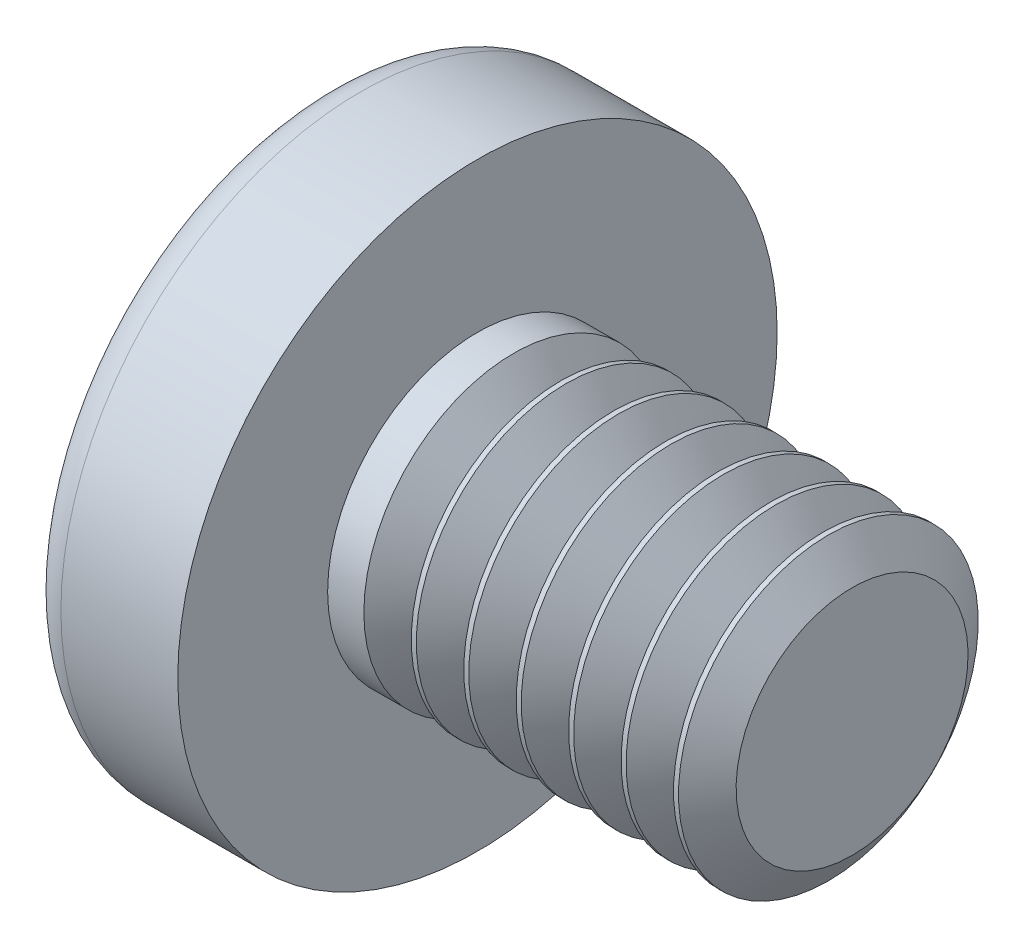
from build123d import *

# Parameters (mm, degrees)
CIRPATTERN1_COUNT = 2
CIRPATTERN1_ANGLE = 90
THDSCHPAT_COUNT   = 7
THDSCHPAT_PITCH   = 0.35


with BuildPart() as part:
    # BodySke → Base-Revolve (revolve)
    with BuildSketch(Plane.XY, mode=Mode.PRIVATE) as base_revolve_sk:
        with BuildLine():
            Line((1.6, 1), (1.6, 2))
            Line((1.6, 2), (0.820084035, 2))
            ThreePointArc((0.820084035, 2), (0.712029995, 1.974299613), (0.627117876, 1.902702703))
            ThreePointArc((0.627117876, 1.902702703), (0.160820604, 1.001692868), (0, 0))
            Line((0, 0), (4.1, 0))
            Line((4.1, 0), (4.1, 1))
            Line((4.1, 1), (1.6, 1))
        make_face()
    revolve(base_revolve_sk.sketch.rotate(Axis((-25.4, 0, 0), (1, 0, 0)), 90), axis=Axis((-25.4, 0, 0), (1, 0, 0)))

    # Sketch3 → Cut-Loft1 section 0
    with BuildSketch(Plane(origin=(0, 0, 0), x_dir=(0, 0, -1), z_dir=(1, 0, 0))):
        with BuildLine():
            Line((0.24, -0.91), (-0.24, -0.91))
            Line((-0.24, -0.91), (-0.24, 0.91))
            Line((-0.24, 0.91), (0.24, 0.91))
            Line((0.24, 0.91), (0.24, -0.91))
        make_face()
    # Sketch4 → Cut-Loft1 section 1
    with BuildSketch(Plane(origin=(1.19, 0, 0), x_dir=(0, 0, -1), z_dir=(1, 0, 0))):
        with BuildLine():
            Line((0.12, -0.12), (-0.12, -0.12))
            Line((-0.12, -0.12), (-0.12, 0.12))
            Line((-0.12, 0.12), (0.12, 0.12))
            Line((0.12, 0.12), (0.12, -0.12))
        make_face()
    cut_loft1 = loft(mode=Mode.SUBTRACT)

    # CirPattern1: Cut-Loft1 ×2 about axis
    cirpattern1_axis = Axis((0, 0, 0), (1, 0, 0))
    for i in range(1, CIRPATTERN1_COUNT):
        add(cut_loft1.rotate(cirpattern1_axis, i * CIRPATTERN1_ANGLE / (CIRPATTERN1_COUNT - 1)), mode=Mode.SUBTRACT)

    # ThdSchSke → ThreadSchematic (revolve, cut)
    with BuildSketch(Plane.XY, mode=Mode.PRIVATE) as threadschematic_sk:
        Polygon((2, -0.774), (1.841753096, -1), (1.841753096, -1.25), (2.158246904, -1.25), (2.158246904, -1), align=None)
    threadschematic = revolve(threadschematic_sk.sketch.rotate(Axis((-3.175, 0, 0), (1, 0, 0)), 270), axis=Axis((-3.175, 0, 0), (1, 0, 0)), mode=Mode.SUBTRACT)

    # ThdSchPat: ThreadSchematic ×7
    with Locations(*[(i * THDSCHPAT_PITCH, 0, 0) for i in range(1, THDSCHPAT_COUNT)]):
        add(threadschematic, mode=Mode.SUBTRACT)


solid = part.part
